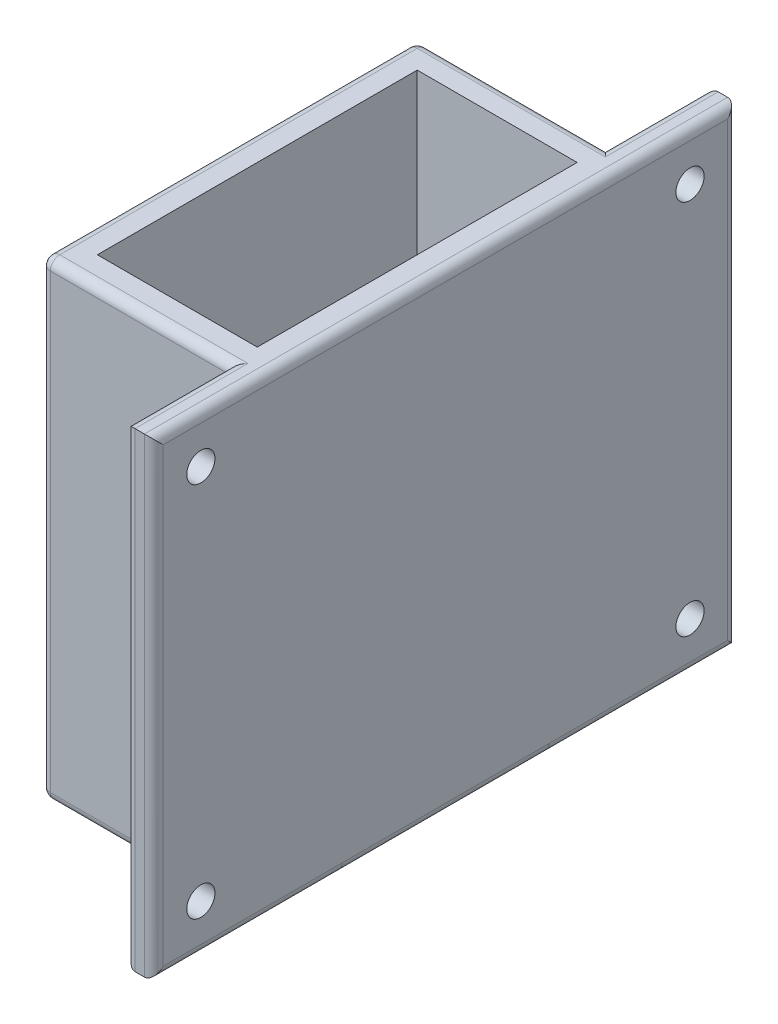
from build123d import *

# Parameters (mm, degrees)
CROQUIS2_W              = 23
CROQUIS2_H              = 40
SALIENTE_EXTRUIR1_DEPTH = 50
CROQUIS3_W              = 17
CROQUIS3_H              = 34
CORTAR_EXTRUIR1_DEPTH   = 45
REDONDEO1_R             = 1
CROQUIS5_W              = 20
CROQUIS5_H              = 50
CROQUIS5_R              = 1.5
SALIENTE_EXTRUIR3_DEPTH = 3
REDONDEO2_R             = 1


with BuildPart() as part:
    # Croquis2 → Saliente-Extruir1 (new body)
    with BuildSketch(Plane(origin=(0, 0, 0), x_dir=(1, 0, 0), z_dir=(0, 1, 0))):
        with Locations((-11.5, 20)):
            Rectangle(CROQUIS2_W, CROQUIS2_H)
    extrude(amount=SALIENTE_EXTRUIR1_DEPTH)

    # Croquis3 → Cortar-Extruir1 (cut)
    with BuildSketch(Plane(origin=(0, 50, 0), x_dir=(1, 0, 0), z_dir=(0, 1, 0))):
        with Locations((-11.5, 20)):
            Rectangle(CROQUIS3_W, CROQUIS3_H)
    extrude(amount=-CORTAR_EXTRUIR1_DEPTH, mode=Mode.SUBTRACT)

    # Redondeo1
    redondeo1_edges = [part.edges().sort_by_distance(p)[0] for p in [
        (-11.5, 0, 0),
        (-23, 0, -20),
        (-11.5, 0, -40),
        (0, 0, -20),
        (0, 25, 0),
        (-23, 25, 0),
        (-23, 25, -40),
        (0, 25, -40),
    ]]
    fillet(redondeo1_edges, radius=REDONDEO1_R)

    # Croquis5 → Saliente-Extruir3 (add)
    # profile 1 of 2: a face of its own
    with BuildSketch(Plane(origin=(0, 0, 0), x_dir=(0, 0, -1), z_dir=(1, 0, 0))):
        with Locations((-1, 25)):
            Rectangle(CROQUIS5_W, CROQUIS5_H)
        with Locations((-6, 45)):
            Circle(CROQUIS5_R, mode=Mode.SUBTRACT)
        with Locations((-6, 5)):
            Circle(CROQUIS5_R, mode=Mode.SUBTRACT)
    # profile 2 of 2: a face of its own
    with BuildSketch(Plane(origin=(0, 0, 0), x_dir=(0, 0, -1), z_dir=(1, 0, 0))):
        with Locations((41, 25)):
            Rectangle(CROQUIS5_W, CROQUIS5_H)
        with Locations((46, 5)):
            Circle(CROQUIS5_R, mode=Mode.SUBTRACT)
        with Locations((46, 45)):
            Circle(CROQUIS5_R, mode=Mode.SUBTRACT)
    extrude(amount=-SALIENTE_EXTRUIR3_DEPTH)

    # Redondeo2
    redondeo2_edges = [part.edges().sort_by_distance(p)[0] for p in [
        (-12.5, 50, 0),
        (-22.707106781, 50, -0.292893219),
        (-23, 50, -20),
        (-22.707106781, 50, -39.707106781),
        (-12.5, 50, -40),
        (-3, 0, -45),
        (-3, 25, -51),
        (-3, 50, -45.5),
        (0, 25, -51),
        (0, 0, -41),
        (0, 0, 1),
        (0, 25, 11),
        (-3, 25, 11),
        (0, 50, -20),
        (-3, 50, 5.5),
        (-3, 0, 5),
    ]]
    fillet(redondeo2_edges, radius=REDONDEO2_R)


solid = part.part
